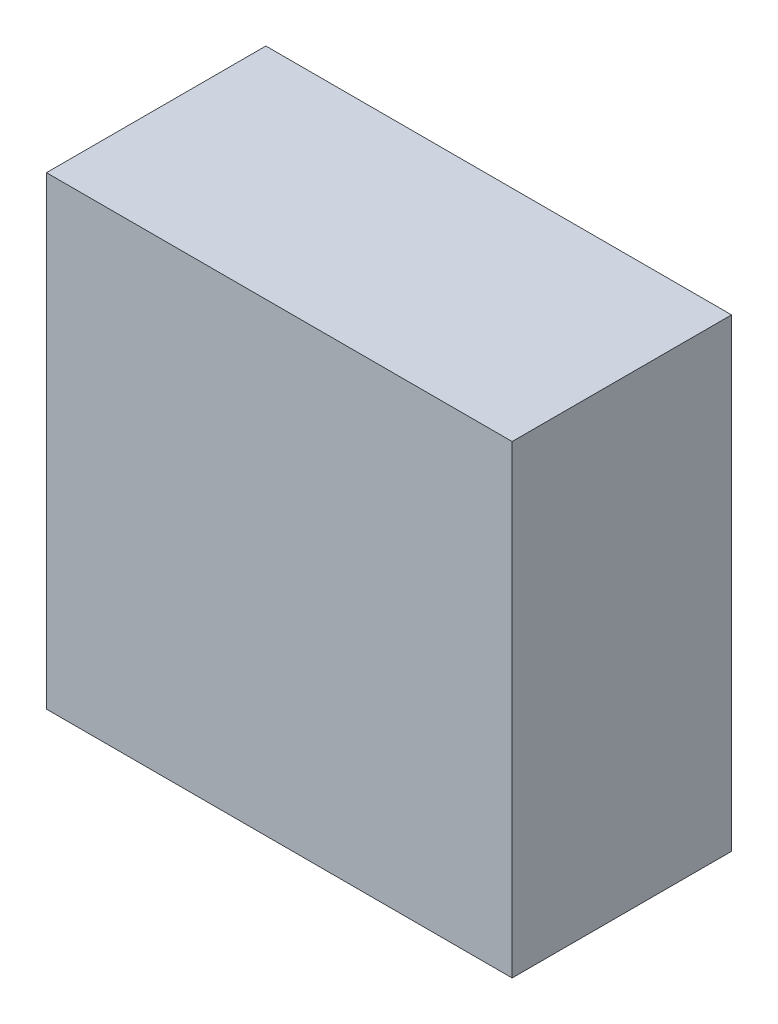
from build123d import *

# Parameters (mm, degrees)
SKETCH1_W               = 2.122566
SKETCH1_H               = 2.1176
COMPONENT_OUTLINE_DEPTH = 1


with BuildPart() as part:
    # Sketch1 → Component_Outline (new body)
    with BuildSketch(Plane.XY):
        with Locations((-0.045283, -0.0428)):
            Rectangle(SKETCH1_W, SKETCH1_H)
    extrude(amount=COMPONENT_OUTLINE_DEPTH)


solid = part.part
